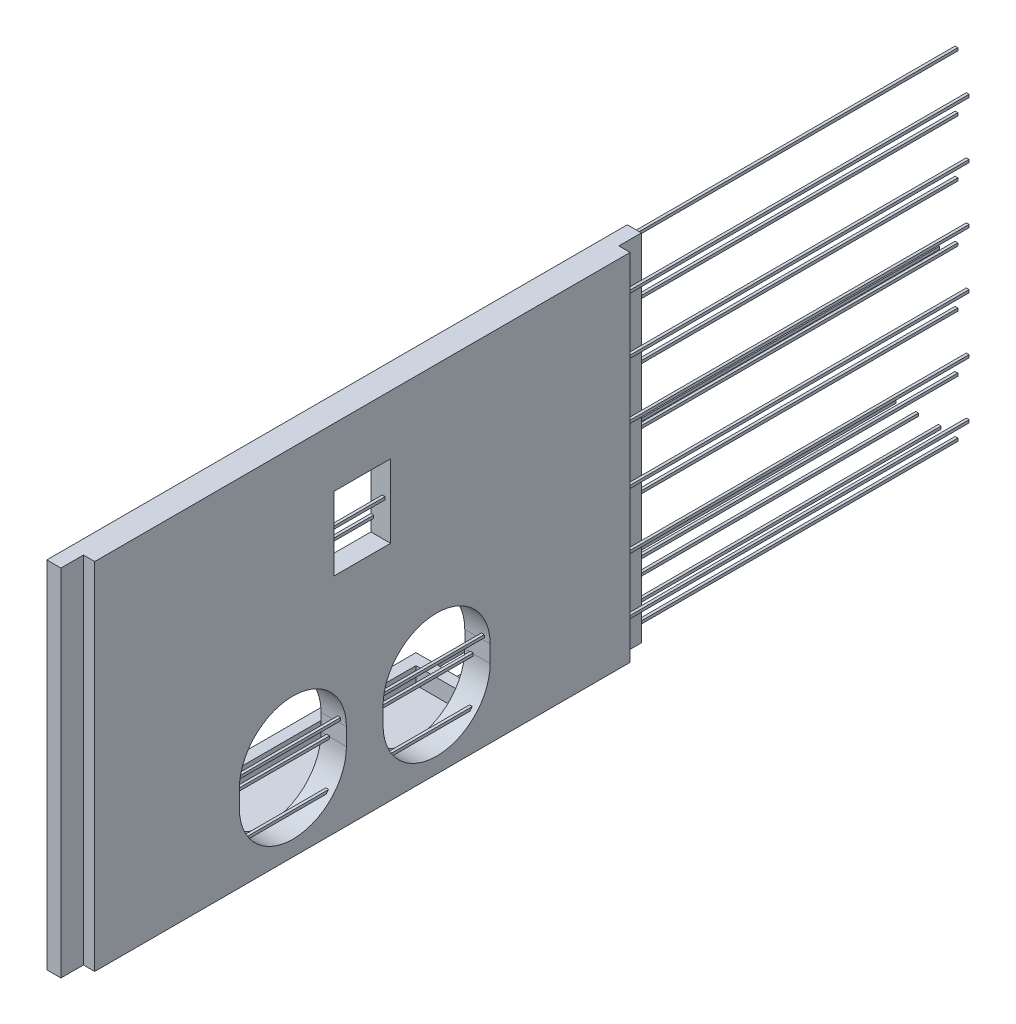
from build123d import *

# Parameters (mm, degrees)
SKETCH_1_W          = 2.5
SKETCH_1_H          = 103
SKETCH_1_W_2        = 2
SKETCH_1_H_2        = 95
EXTRUDE_1_DEPTH     = 63
SKETCH_5_W          = 50
SKETCH_5_H          = 2
EXTRUDE_2_DEPTH     = 11
EXTRUDE_3_DEPTH     = 3
CUT_EXTRUDE_1_DEPTH = 4.5
SKETCH_11_W         = 8.5
SKETCH_11_H         = 11.5
CUT_EXTRUDE_2_DEPTH = 4.5
SKETCH_12_W         = 26
SKETCH_12_H         = 28
SKETCH_12_W_2       = 25
SKETCH_12_H_2       = 27
SKETCH_12_W_3       = 8.5
SKETCH_12_H_3       = 11.5
CUT_EXTRUDE_3_DEPTH = 1
SKETCH_13_W         = 30
SKETCH_13_H         = 2
EXTRUDE_4_DEPTH     = 4
EXTRUDE_5_DEPTH     = 3
SKETCH_15_W         = 10
SKETCH_15_H         = 13
CUT_EXTRUDE_5_DEPTH = 10
EXTRUDE_START       = -73.34
SKETCH_16_W         = 0.5
SKETCH_16_H         = 0.5
EXTRUDE_6_DEPTH     = 130.501615
EXTRUDE_START_2     = -69.328472
SKETCH_17_W         = 0.5
SKETCH_17_H         = 0.5
EXTRUDE_7_DEPTH     = 130.490087
SKETCH_18_W         = 0.5
SKETCH_18_H         = 0.5
EXTRUDE_8_DEPTH     = 83.66161453
SKETCH_19_W         = 0.5
SKETCH_19_H         = 0.5
EXTRUDE_9_DEPTH     = 93.66161453


with BuildPart() as part:
    # 스케치1 → 보스-돌출1 (new body)
    with BuildSketch(Plane(origin=(0, 0, 0), x_dir=(1, 0, 0), z_dir=(0, 1, 0))):
        with Locations((-1, 0)):
            Rectangle(SKETCH_1_W, SKETCH_1_H)
        with Locations((1.25, 0)):
            Rectangle(SKETCH_1_W_2, SKETCH_1_H_2)
    extrude(amount=EXTRUDE_1_DEPTH)

    # 스케치5 → 보스-돌출2 (add)
    with BuildSketch(Plane.ZY.offset(2.25)):
        with Locations((0, 1)):
            Rectangle(SKETCH_5_W, SKETCH_5_H)
    extrude(amount=EXTRUDE_2_DEPTH)

    # 스케치7 → 보스-돌출3 (add)
    with BuildSketch(Plane(origin=(0, 2, 0), x_dir=(1, 0, 0), z_dir=(0, 1, 0))):
        Polygon((-2.25, 23), (-11.25, 23), (-11.25, -23), (-2.25, -23), (-2.25, -25), (-13.25, -25), (-13.25, 25), (-2.25, 25), align=None)
    extrude(amount=EXTRUDE_3_DEPTH)

    # 스케치10 → 컷-돌출1 (cut)
    with BuildSketch(Plane(origin=(2.25, 0, 0), x_dir=(0, 0, -1), z_dir=(1, 0, 0))):
        with BuildLine():
            Line((-21.84, 15.25), (-21.84, 12.25))
            ThreePointArc((-21.84, 12.25), (-12.34, 2.75), (-2.84, 12.25))
            Line((-2.84, 12.25), (-2.84, 15.25))
            ThreePointArc((-2.84, 15.25), (-12.34, 24.75), (-21.84, 15.25))
        make_face()
        with BuildLine():
            Line((3.66, 15.25), (3.66, 12.25))
            ThreePointArc((3.66, 12.25), (13.16, 2.75), (22.66, 12.25))
            Line((22.66, 12.25), (22.66, 15.25))
            ThreePointArc((22.66, 15.25), (13.16, 24.75), (3.66, 15.25))
        make_face()
    extrude(amount=-CUT_EXTRUDE_1_DEPTH, mode=Mode.SUBTRACT)

    # 스케치11 → 컷-돌출2 (cut)
    with BuildSketch(Plane.ZY.offset(2.25)):
        with Locations((0, 46.05)):
            Rectangle(SKETCH_11_W, SKETCH_11_H)
    extrude(amount=-CUT_EXTRUDE_2_DEPTH, mode=Mode.SUBTRACT)

    # 스케치12 → 컷-돌출3 (cut)
    # profile 1 of 2: a face of its own
    with BuildSketch(Plane.ZY.offset(2.25)):
        with Locations((0, 43.5)):
            Rectangle(SKETCH_12_W, SKETCH_12_H)
        with Locations((0, 43.5)):
            Rectangle(SKETCH_12_W_2, SKETCH_12_H_2, mode=Mode.SUBTRACT)
    # profile 2 of 2: a face of its own
    with BuildSketch(Plane.ZY.offset(2.25)):
        with Locations((0, 43.5)):
            Rectangle(SKETCH_12_W_2, SKETCH_12_H_2)
        with Locations((0, 46.05)):
            Rectangle(SKETCH_12_W_3, SKETCH_12_H_3, mode=Mode.SUBTRACT)
    extrude(amount=-CUT_EXTRUDE_3_DEPTH, mode=Mode.SUBTRACT)

    # 스케치13 → 보스-돌출4 (add)
    with BuildSketch(Plane.ZY.offset(2.25)):
        with Locations((0, 28.5)):
            Rectangle(SKETCH_13_W, SKETCH_13_H)
    extrude(amount=EXTRUDE_4_DEPTH)

    # 스케치14 → 보스-돌출5 (add)
    with BuildSketch(Plane(origin=(0, 29.5, 0), x_dir=(1, 0, 0), z_dir=(0, 1, 0))):
        Polygon((-2.25, -13), (-2.25, -15), (-6.25, -15), (-6.25, 15), (-2.25, 15), (-2.25, 13), (-4.25, 13), (-4.25, -13), align=None)
    extrude(amount=EXTRUDE_5_DEPTH)

    # 스케치15 → 컷-돌출5 (cut)
    with BuildSketch(Plane(origin=(2.25, 0, 0), x_dir=(0, 0, -1), z_dir=(1, 0, 0))):
        with Locations((0, 46.05)):
            Rectangle(SKETCH_15_W, SKETCH_15_H)
    extrude(amount=-CUT_EXTRUDE_5_DEPTH, mode=Mode.SUBTRACT)

    # 스케치16 → 보스-돌출6 (add)
    with BuildSketch(Plane(origin=(0, 0, -51.5), x_dir=(-1, 0, 0), z_dir=(0, 0, -1)).offset(EXTRUDE_START)):
        with Locations((1, 2.138286898)):
            Rectangle(SKETCH_16_W, SKETCH_16_H)
        with Locations((1, 12.138286898)):
            Rectangle(SKETCH_16_W, SKETCH_16_H)
        with Locations((1, 22.138286898)):
            Rectangle(SKETCH_16_W, SKETCH_16_H)
        with Locations((1, 32.138286898)):
            Rectangle(SKETCH_16_W, SKETCH_16_H)
        with Locations((1, 42.138286898)):
            Rectangle(SKETCH_16_W, SKETCH_16_H)
        with Locations((1, 52.138286898)):
            Rectangle(SKETCH_16_W, SKETCH_16_H)
        with Locations((1, 62.138286898)):
            Rectangle(SKETCH_16_W, SKETCH_16_H)
    extrude(amount=EXTRUDE_6_DEPTH)

    # 스케치17 → 보스-돌출7 (add)
    with BuildSketch(Plane(origin=(0, 0, -47.5), x_dir=(-1, 0, 0), z_dir=(0, 0, -1)).offset(EXTRUDE_START_2)):
        with Locations((-1, 5.967868798)):
            Rectangle(SKETCH_17_W, SKETCH_17_H)
        with Locations((-1, 15.967868798)):
            Rectangle(SKETCH_17_W, SKETCH_17_H)
        with Locations((-1, 25.967868798)):
            Rectangle(SKETCH_17_W, SKETCH_17_H)
        with Locations((-1, 35.967868798)):
            Rectangle(SKETCH_17_W, SKETCH_17_H)
        with Locations((-1, 45.967868798)):
            Rectangle(SKETCH_17_W, SKETCH_17_H)
        with Locations((-1, 55.967868798)):
            Rectangle(SKETCH_17_W, SKETCH_17_H)
    extrude(amount=EXTRUDE_7_DEPTH)

    # 스케치18 → 보스-돌출8 (add)
    with BuildSketch(Plane(origin=(0, 0, -25), x_dir=(-1, 0, 0), z_dir=(0, 0, -1))):
        with Locations((3.97675174, 2.5)):
            Rectangle(SKETCH_18_W, SKETCH_18_H)
        with Locations((7.97675174, 2.5)):
            Rectangle(SKETCH_18_W, SKETCH_18_H)
        with Locations((11.97675174, 2.5)):
            Rectangle(SKETCH_18_W, SKETCH_18_H)
    extrude(amount=EXTRUDE_8_DEPTH)

    # 스케치19 → 보스-돌출9 (add)
    with BuildSketch(Plane(origin=(0, 0, -15), x_dir=(-1, 0, 0), z_dir=(0, 0, -1))):
        with Locations((4.25, 30)):
            Rectangle(SKETCH_19_W, SKETCH_19_H)
    extrude(amount=EXTRUDE_9_DEPTH)


solid = part.part
